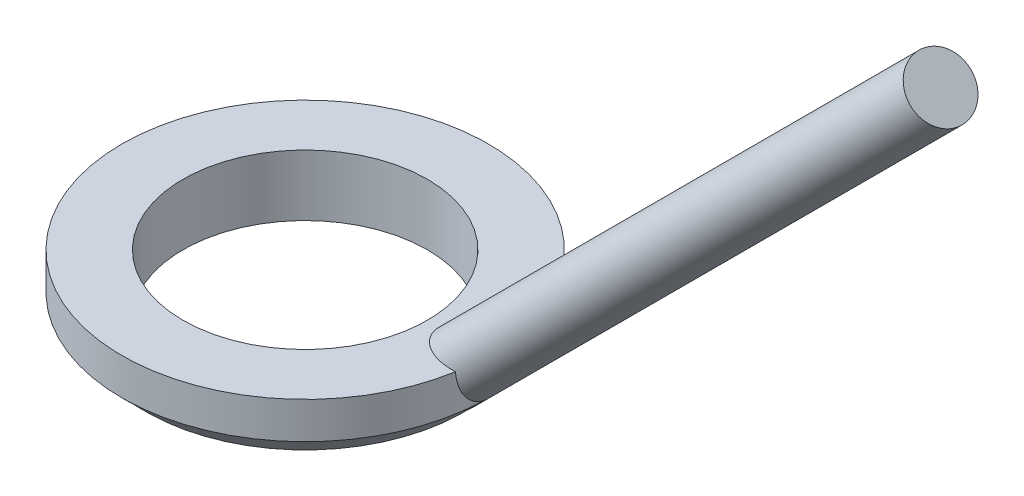
from build123d import *

# Parameters (mm, degrees)
SKETCH1_W     = 6.35
SKETCH1_H     = 6.35
CHAMFER1_SIZE = 2.54


with BuildPart() as part:
    # Sketch1 → Revolve1 (revolve)
    with BuildSketch(Plane.XY, mode=Mode.PRIVATE) as revolve1_sk:
        with Locations((15.875, 3.175)):
            Rectangle(SKETCH1_W, SKETCH1_H)
    revolve(revolve1_sk.sketch.rotate(Axis((0, 0, 0), (0, 1, 0)), 90), axis=Axis((0, 0, 0), (0, 1, 0)))

    # Chamfer1
    chamfer1_edges = [part.edges().sort_by_distance(p)[0] for p in [
        (0, 0, 19.05),
    ]]
    chamfer(chamfer1_edges, length=CHAMFER1_SIZE)

    # Sketch2 → Revolve2 (revolve)
    with BuildSketch(Plane.XY, mode=Mode.PRIVATE) as revolve2_sk:
        Polygon((15.24, 3.175), (66.04, 53.975), (63.79493597, 56.22006403), (12.99493597, 5.42006403), align=None)
    revolve(revolve2_sk.sketch.rotate(Axis((15.24, 3.175, 0), (0.7071067811865512, 0.7071067811865438, 0)), 180), axis=Axis((15.24, 3.175, 0), (0.7071067811865512, 0.7071067811865438, 0)))


solid = part.part
